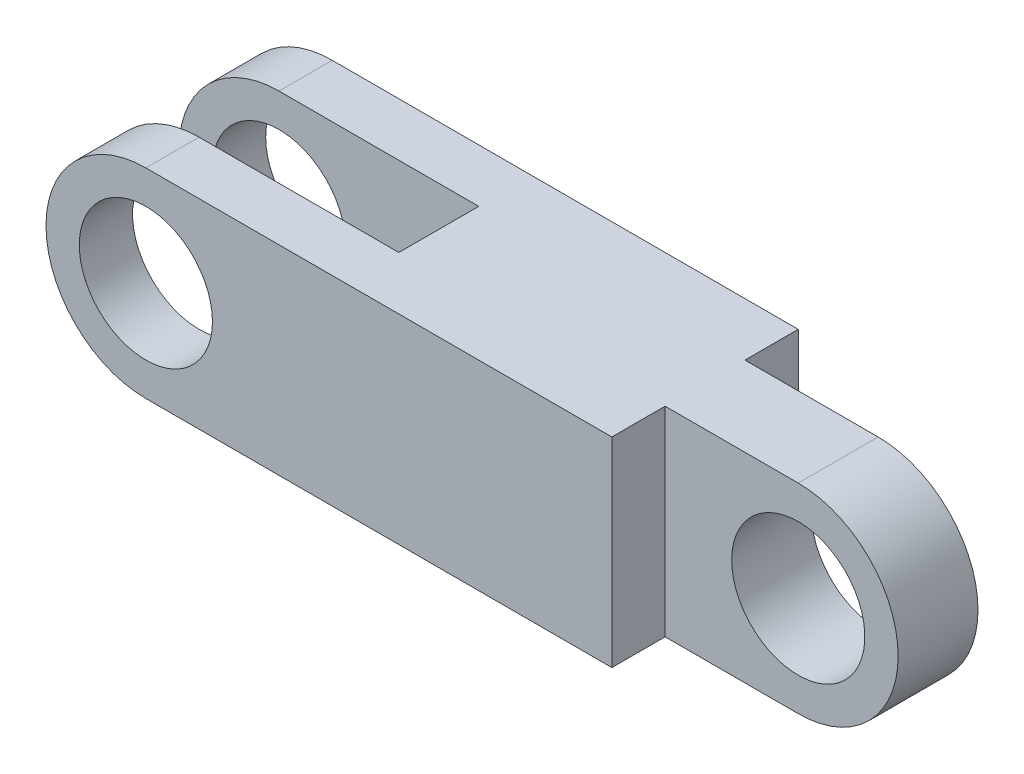
from build123d import *

# Parameters (mm, degrees)
BOSS_EXTRU_1_DEPTH      = 14
ESQUISSE2_W             = 7.5
ESQUISSE2_H             = 6
ESQUISSE2_W_2           = 15
ESQUISSE2_W_3           = 10
ESQUISSE2_H_2           = 4
ENL_V_MAT_EXTRU_1_DEPTH = 15


with BuildPart() as part:
    # Esquisse1 → Boss.-Extru.1 (new body)
    with BuildSketch(Plane.XY):
        with BuildLine():
            ThreePointArc((7.5, 7.5), (5.303300859, 2.196699141), (0, 0))
            Line((0, 0), (45, 0))
            ThreePointArc((45, 0), (37.5, 7.5), (45, 15))
            Line((45, 15), (0, 15))
            ThreePointArc((0, 15), (5.303300859, 12.803300859), (7.5, 7.5))
        make_face()
        with BuildLine():
            ThreePointArc((45, 15), (37.5, 7.5), (45, 0))
            Line((45, 0), (45, 2.5))
            ThreePointArc((45, 2.5), (40, 7.5), (45, 12.5))
            Line((45, 12.5), (45, 15))
        make_face()
        with BuildLine():
            Line((45, 2.5), (45, 0))
            ThreePointArc((45, 0), (50.303300859, 2.196699141), (52.5, 7.5))
            ThreePointArc((52.5, 7.5), (50.303300859, 12.803300859), (45, 15))
            Line((45, 15), (45, 12.5))
            ThreePointArc((45, 12.5), (48.535533906, 11.035533906), (50, 7.5))
            ThreePointArc((50, 7.5), (48.535533906, 3.964466094), (45, 2.5))
        make_face()
        with BuildLine():
            ThreePointArc((0, 15), (-7.5, 7.5), (0, 0))
            Line((0, 0), (0, 2.5))
            ThreePointArc((0, 2.5), (-5, 7.5), (0, 12.5))
            Line((0, 12.5), (0, 15))
        make_face()
        with BuildLine():
            Line((0, 2.5), (0, 0))
            ThreePointArc((0, 0), (5.303300859, 2.196699141), (7.5, 7.5))
            ThreePointArc((7.5, 7.5), (5.303300859, 12.803300859), (0, 15))
            Line((0, 15), (0, 12.5))
            ThreePointArc((0, 12.5), (3.535533906, 11.035533906), (5, 7.5))
            ThreePointArc((5, 7.5), (3.535533906, 3.964466094), (0, 2.5))
        make_face()
    extrude(amount=BOSS_EXTRU_1_DEPTH)

    # Esquisse2 → Enlèv. mat.-Extru.1 (cut)
    with BuildSketch(Plane(origin=(0, 15, 0), x_dir=(1, 0, 0), z_dir=(0, 1, 0))):
        with Locations((-3.75, -7)):
            Rectangle(ESQUISSE2_W, ESQUISSE2_H)
        with Locations((7.5, -7)):
            Rectangle(ESQUISSE2_W_2, ESQUISSE2_H)
        with Locations((40, -2)):
            Rectangle(ESQUISSE2_W_3, ESQUISSE2_H_2)
        with Locations((48.75, -2)):
            Rectangle(ESQUISSE2_W, ESQUISSE2_H_2)
        with Locations((48.75, -12)):
            Rectangle(ESQUISSE2_W, ESQUISSE2_H_2)
        with Locations((40, -12)):
            Rectangle(ESQUISSE2_W_3, ESQUISSE2_H_2)
    extrude(amount=-ENL_V_MAT_EXTRU_1_DEPTH, mode=Mode.SUBTRACT)


solid = part.part
